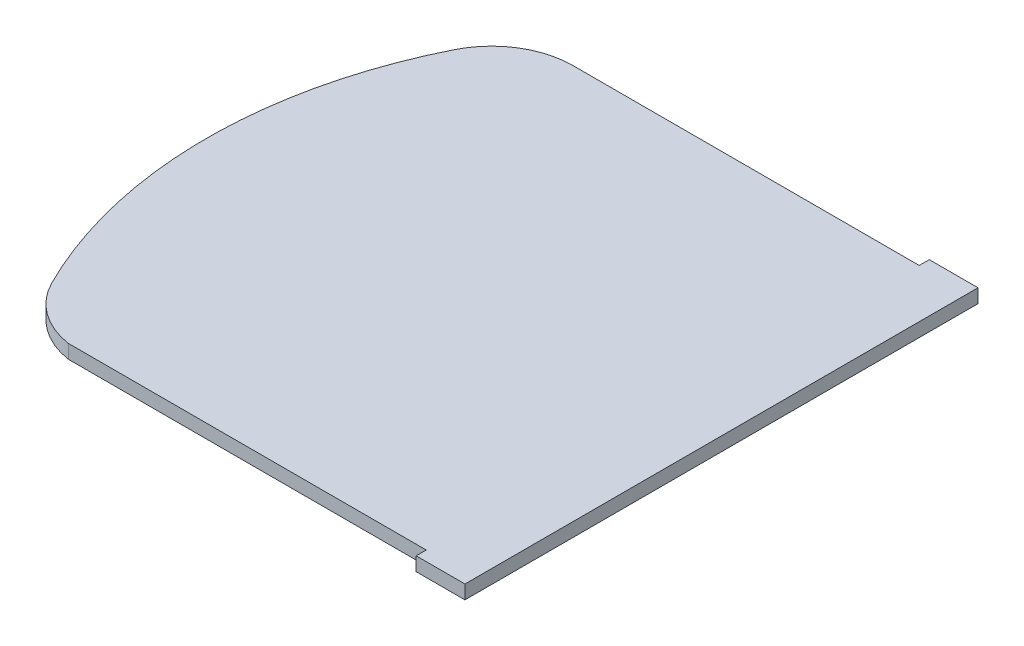
from build123d import *

# Parameters (mm, degrees)
BOSS_EXTRUDE1_DEPTH = 6.5


with BuildPart() as part:
    # Sketch1 → Boss-Extrude1 (new, symmetric)
    with BuildSketch(Plane(origin=(0, 0, 0), x_dir=(1, 0, 0), z_dir=(0, 1, 0))):
        with BuildLine():
            Line((0, 242), (0, -242))
            Line((0, -242), (-46, -242))
            Line((-46, -242), (-46, -232.5))
            Line((-46, -232.5), (-383.656025613, -232.5))
            ThreePointArc((-383.656025613, -232.5), (-417.305553076, -218.648136781), (-440.836676218, -190.891136639))
            ThreePointArc((-440.836676218, -190.891136639), (-485.999569897, -0.605349387), (-441.377653297, 189.808022923))
            ThreePointArc((-441.377653297, 189.808022923), (-412.985038869, 220.962652578), (-372.443194837, 232.5))
            Line((-372.443194837, 232.5), (-46, 232.5))
            Line((-46, 232.5), (-46, 242))
            Line((-46, 242), (0, 242))
        make_face()
    extrude(amount=BOSS_EXTRUDE1_DEPTH, both=True)


solid = part.part
